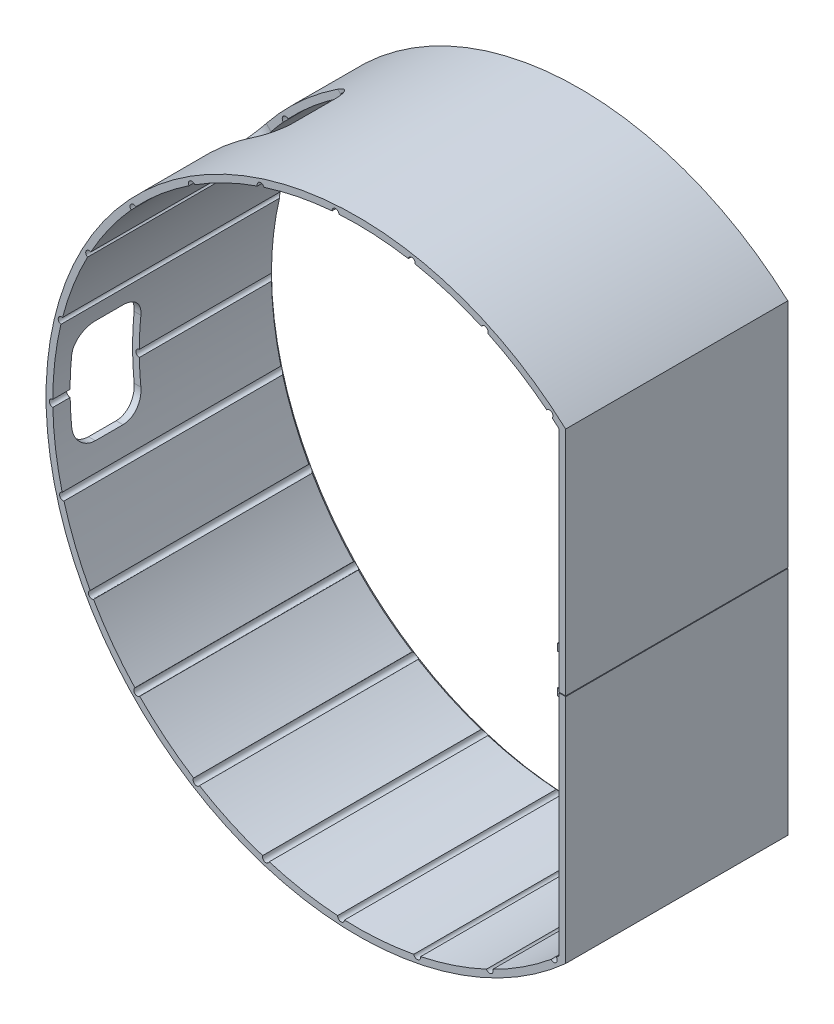
from build123d import *

# Parameters (mm, degrees)
BOSS_EXTRUDE1_DEPTH     = 64.2
SKETCH3_W               = 24
SKETCH3_H               = 40
CUT_EXTRUDE1_DEPTH      = 120.2
SKETCH4_W               = 30
SKETCH4_H               = 20
CUT_EXTRUDE2_DEPTH      = 120.2
FILLET1_R               = 6
SKETCH5_W               = 2
SKETCH5_H               = 9
BOSS_EXTRUDE2_DEPTH     = 6
BOSS_EXTRUDE3_DEPTH     = 9
CHAMFER1_SIZE           = 1
SKETCH9_R               = 1
CUT_EXTRUDE5_DEPTH      = 100
MIRROR2_COPY_1_SKETCH_W = 2
MIRROR2_COPY_1_SKETCH_H = 9
MIRROR2_COPY_1_DEPTH    = 6
MIRROR2_COPY_2_DEPTH    = 9


with BuildPart() as part:
    # Sketch1 → Boss-Extrude1 (new body)
    with BuildSketch(Plane(origin=(0, 0, 0), x_dir=(0, 1, 0), z_dir=(0, 0, 1))):
        with BuildLine():
            Line((-66.902615793, -60.2), (-0.1, -60.2))
            Line((-0.1, -60.2), (-0.1, -58.3))
            Line((-0.1, -58.3), (-65.984183711, -58.3))
            ThreePointArc((-65.984183711, -58.3), (0, 88.05), (65.984183711, -58.3))
            Line((65.984183711, -58.3), (0.1, -58.3))
            Line((0.1, -58.3), (0.1, -60.2))
            Line((0.1, -60.2), (66.902615793, -60.2))
            ThreePointArc((66.902615793, -60.2), (0, 90), (-66.902615793, -60.2))
        make_face()
    extrude(amount=BOSS_EXTRUDE1_DEPTH)

    # Sketch3 → Cut-Extrude1 (cut)
    with BuildSketch(Plane(origin=(0, 0, 0), x_dir=(0, 0, -1), z_dir=(0.7071067811865464, -0.7071067811865488, 0))):
        with Locations((-32.2, 3.95)):
            Rectangle(SKETCH3_W, SKETCH3_H)
    extrude(amount=-CUT_EXTRUDE1_DEPTH, mode=Mode.SUBTRACT)

    # Sketch4 → Cut-Extrude2 (cut)
    with BuildSketch(Plane.YZ):
        with Locations((0, 49.2)):
            Rectangle(SKETCH4_W, SKETCH4_H)
    extrude(amount=-CUT_EXTRUDE2_DEPTH, mode=Mode.SUBTRACT)

    # Fillet1
    fillet1_edges = [part.edges().sort_by_distance(p)[0] for p in [
        (-73.267623998, 50.569496322, 44.2),
        (-43.693886042, 77.564300861, 44.2),
        (-43.693886042, 77.564300861, 20.2),
        (-73.267623998, 50.569496322, 20.2),
        (-87.752053224, -15, 39.2),
        (-87.752053224, -15, 59.2),
        (-87.752053224, 15, 59.2),
        (-87.752053224, 15, 39.2),
    ]]
    fillet(fillet1_edges, radius=FILLET1_R)

    # Sketch5 → Boss-Extrude2 (add)
    with BuildSketch(Plane(origin=(58.3, 0, 0), x_dir=(0, -1, 0), z_dir=(-1, 0, 0))):
        with Locations((-5.584183711, 54.2)):
            Rectangle(SKETCH5_W, SKETCH5_H)
    boss_extrude2 = extrude(amount=BOSS_EXTRUDE2_DEPTH)

    # Sketch6 → Boss-Extrude3 (add)
    with BuildSketch(Plane.XY.offset(58.7)):
        Polygon((56.1, 6.584183711), (56.1, 7.784183711), (52.3, 6.584183711), align=None)
    boss_extrude3 = extrude(amount=-BOSS_EXTRUDE3_DEPTH)

    # Chamfer1
    chamfer1_edges = [part.edges().sort_by_distance(p)[0] for p in [
        (58.3, 33.042091855, 0),
        (-88.05, 0, 0),
        (58.3, -33.042091855, 0),
    ]]
    chamfer(chamfer1_edges, length=CHAMFER1_SIZE)

    # Sketch9 → Cut-Extrude5 (cut)
    with BuildSketch(Plane.XY.offset(64.2)):
        with Locations((-88.046387382, -0.797601996)):
            Circle(SKETCH9_R)
        with Locations((-85.478603767, 21.123702281)):
            Circle(SKETCH9_R)
        with Locations((-77.539885109, 41.717726656)):
            Circle(SKETCH9_R)
        with Locations((-64.729050297, 59.690472838)):
            Circle(SKETCH9_R)
        with Locations((-47.851051199, 73.912647085)):
            Circle(SKETCH9_R)
        with Locations((-27.96639457, 83.490617885)):
            Circle(SKETCH9_R)
        with Locations((-6.324506517, 87.822566105)):
            Circle(SKETCH9_R)
        with Locations((15.714773541, 86.636299509)):
            Circle(SKETCH9_R)
        with Locations((36.766636582, 80.006355588)):
            Circle(SKETCH9_R)
        with Locations((55.508316628, 68.349318103)):
            Circle(SKETCH9_R)
        with Locations((56.737442428, -67.33249681)):
            Circle(SKETCH9_R)
        with Locations((38.210020307, -79.327150763)):
            Circle(SKETCH9_R)
        with Locations((17.281722084, -86.337388088)):
            Circle(SKETCH9_R)
        with Locations((-4.732450296, -87.922729793)):
            Circle(SKETCH9_R)
        with Locations((-26.449265419, -83.983563027)):
            Circle(SKETCH9_R)
        with Locations((-46.504175922, -74.767400127)):
            Circle(SKETCH9_R)
        with Locations((-63.637058022, -60.853326502)):
            Circle(SKETCH9_R)
        with Locations((-76.771389725, -43.11561457)):
            Circle(SKETCH9_R)
        with Locations((-85.081892666, -22.668790006)):
            Circle(SKETCH9_R)
    extrude(amount=-CUT_EXTRUDE5_DEPTH, mode=Mode.SUBTRACT)

    # Mirror1: Boss-Extrude2, Boss-Extrude3 across plane
    add(boss_extrude2.mirror(Plane.ZX))
    add(boss_extrude3.mirror(Plane.ZX))

    # Mirror2: Boss-Extrude2, Boss-Extrude3 across plane
    add(boss_extrude2.mirror(Plane.XY.offset(32.1)))
    add(boss_extrude3.mirror(Plane.XY.offset(32.1)))

    # Mirror2 copy 1 sketch → Mirror2 copy 1 (add)
    with BuildSketch(Plane(origin=(58.3, 0, 64.2), x_dir=(0, 1, 0), z_dir=(-1, 0, 0))):
        with Locations((-5.584183711, 54.2)):
            Rectangle(MIRROR2_COPY_1_SKETCH_W, MIRROR2_COPY_1_SKETCH_H)
    extrude(amount=MIRROR2_COPY_1_DEPTH)

    # Mirror2 copy 2 sketch → Mirror2 copy 2 (add)
    with BuildSketch(Plane(origin=(0, 0, 5.5), x_dir=(1, 0, 0), z_dir=(0, 0, -1))):
        Polygon((56.1, 6.584183711), (56.1, 7.784183711), (52.3, 6.584183711), align=None)
    extrude(amount=-MIRROR2_COPY_2_DEPTH)


solid = part.part
